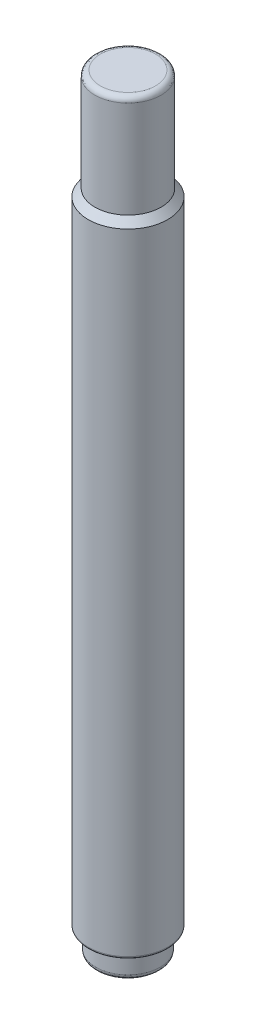
from build123d import *

# Parameters (mm, degrees)
FILLET1_R      = 0.475
FILLET4_R      = 1
SCALE1_SCALE_X = 1.05
SCALE1_SCALE_Y = 1.01
SCALE1_SCALE_Z = 1.05


with BuildPart() as part:
    # Sketch2 → Revolve1 (revolve)
    with BuildSketch(Plane.XY):
        Polygon((0, 72.25), (0, -72.25), (5.85, -72.25), (5.85, -67.75), (7.2, -67.75), (7.2, 51.55), (6, 52.95), (6, 72.25), align=None)
    revolve(axis=Axis((0, 72.25, 0), (0, -1, 0)))

    # Fillet1
    fillet1_edges = [part.edges().sort_by_distance(p)[0] for p in [
        (-5.85, -67.75, 0),
        (-7.2, -67.75, 0),
    ]]
    fillet(fillet1_edges, radius=FILLET1_R)

    # Fillet4
    fillet4_edges = [part.edges().sort_by_distance(p)[0] for p in [
        (-5.85, -72.25, 0),
        (-6, 72.25, 0),
    ]]
    fillet(fillet4_edges, radius=FILLET4_R)


with BuildPart() as part_1:
    # Scale1: scaled about (0, 0, 0)
    add(part.part.scale((SCALE1_SCALE_X, SCALE1_SCALE_Y, SCALE1_SCALE_Z), about=(0, 0, 0)))


solid = part_1.part
